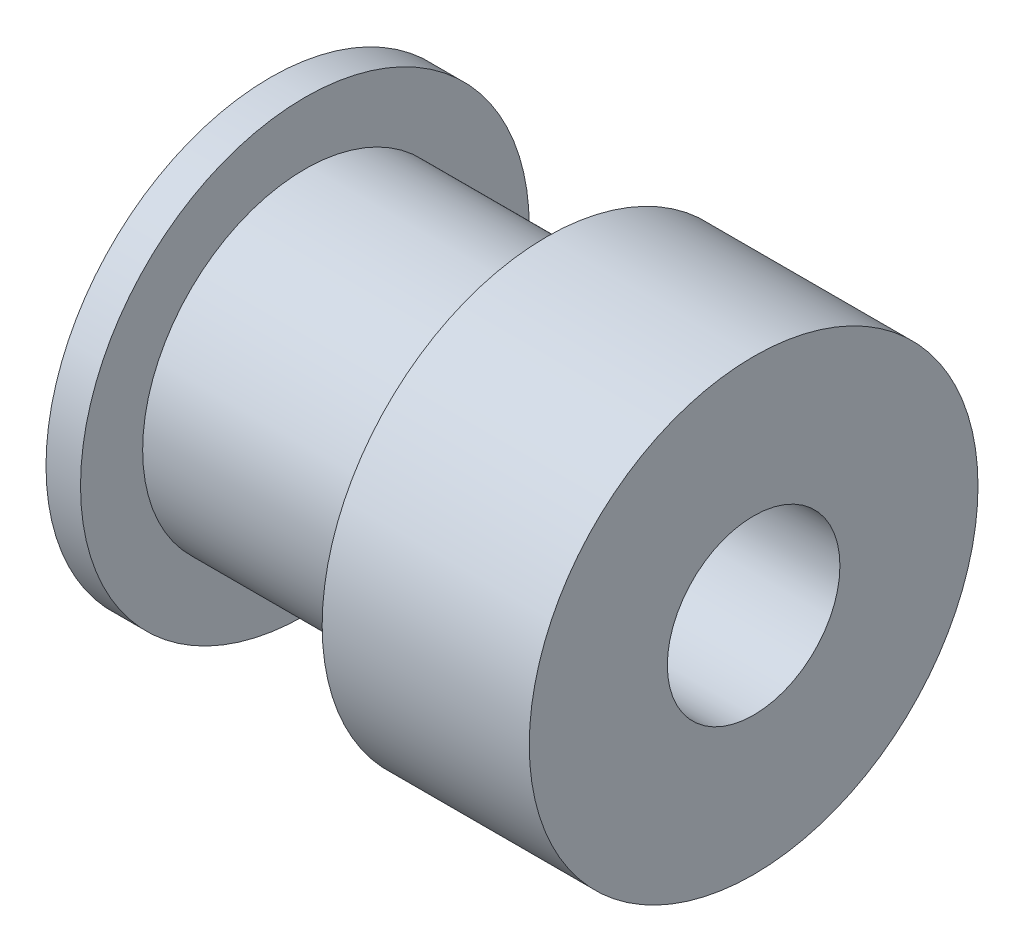
from build123d import *


with BuildPart() as part:
    # Sketch1 → Revolve1 (revolve)
    with BuildSketch(Plane.XY, mode=Mode.PRIVATE) as revolve1_sk:
        Polygon((0, -2.5), (0, -6.5), (1, -6.5), (1, -4.7), (8, -4.7), (8, -6.5), (14, -6.5), (14, -2.5), align=None)
    revolve(revolve1_sk.sketch.rotate(Axis((0, 0, 0), (1, 0, 0)), 270), axis=Axis((0, 0, 0), (1, 0, 0)))


solid = part.part
